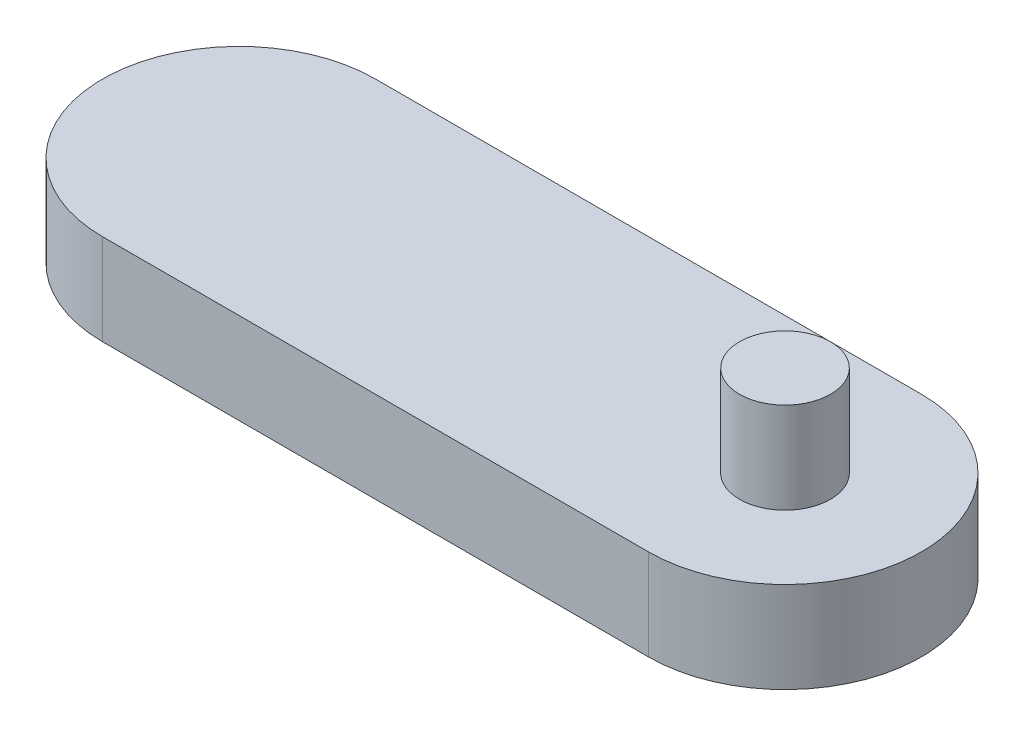
from build123d import *

# Parameters (mm, degrees)
LINK1_DEPTH         = 50.8
SKETCH2_R           = 50.8
BOTTOMCUT_DEPTH     = 25.4
SKETCH3_R           = 25.4
BOSS_EXTRUDE1_DEPTH = 50.8


with BuildPart() as part:
    # Sketch1 → link1 (new body)
    with BuildSketch(Plane(origin=(0, 0, 0), x_dir=(1, 0, 0), z_dir=(0, 1, 0))):
        with BuildLine():
            Line((-152.4, 76.2), (152.4, 76.2))
            ThreePointArc((152.4, 76.2), (228.6, 0), (152.4, -76.2))
            Line((152.4, -76.2), (-152.4, -76.2))
            ThreePointArc((-152.4, -76.2), (-228.6, 0), (-152.4, 76.2))
        make_face()
    extrude(amount=LINK1_DEPTH)

    # Sketch2 → bottomcut (cut)
    with BuildSketch(Plane.XZ):
        with Locations(Location((-152.4, 0, 0), (0, 0, 270))):
            Circle(SKETCH2_R)
    extrude(amount=-BOTTOMCUT_DEPTH, mode=Mode.SUBTRACT)

    # Sketch3 → Boss-Extrude1 (add)
    with BuildSketch(Plane(origin=(0, 50.8, 0), x_dir=(1, 0, 0), z_dir=(0, 1, 0))):
        with Locations(Location((152.4, 0, 0), (0, 0, 270))):
            Circle(SKETCH3_R)
    extrude(amount=BOSS_EXTRUDE1_DEPTH)


solid = part.part
